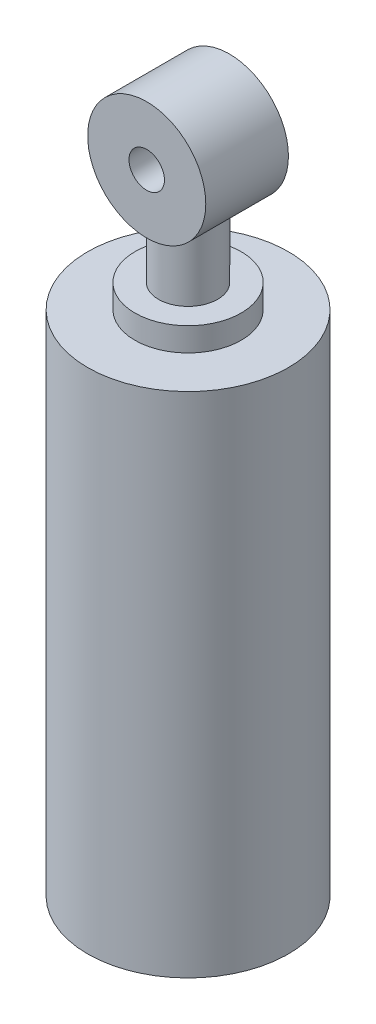
from build123d import *

# Parameters (mm, degrees)
SKETCH_1_R          = 8.5
EXTRUDE_1_DEPTH     = 43
SKETCH_2_R          = 5
EXTRUDE_2_DEPTH     = 3.5
SKETCH_3_R          = 2.5
EXTRUDE_3_DEPTH     = 9
SKETCH_4_R          = 1.5
CUT_EXTRUDE_1_DEPTH = 10
SKETCH_5_R          = 4.5
SKETCH_5_R_2        = 2.5
EXTRUDE_4_DEPTH     = 2


with BuildPart() as part:
    # 草图1 → 凸台-拉伸1 (new body)
    with BuildSketch(Plane(origin=(0, 0, 0), x_dir=(1, 0, 0), z_dir=(0, 1, 0))):
        with Locations(Location((0, 0, 0), (0, 0, 270))):
            Circle(SKETCH_1_R)
    extrude(amount=EXTRUDE_1_DEPTH)



with BuildPart() as body_2:
    # 草图2 → 凸台-拉伸2 (new, symmetric)
    with BuildSketch(Plane.XY):
        with Locations((0, 55)):
            Circle(SKETCH_2_R)
    extrude(amount=EXTRUDE_2_DEPTH, both=True)


with BuildPart() as part_1:
    add(part.part)

    add(body_2.part)  # 凸台-拉伸3 merges body 2
    # 草图3 → 凸台-拉伸3 (add)
    with BuildSketch(Plane(origin=(0, 43, 0), x_dir=(1, 0, 0), z_dir=(0, 1, 0))):
        with Locations(Location((0, 0, 0), (0, 0, 90))):
            Circle(SKETCH_3_R)
    extrude(amount=EXTRUDE_3_DEPTH)

    # 草图4 → 切除-拉伸1 (cut)
    with BuildSketch(Plane.XY.offset(3.5)):
        with Locations((0, 55)):
            Circle(SKETCH_4_R)
    extrude(amount=-CUT_EXTRUDE_1_DEPTH, mode=Mode.SUBTRACT)

    # 草图5 → 凸台-拉伸4 (add)
    with BuildSketch(Plane(origin=(0, 43, 0), x_dir=(1, 0, 0), z_dir=(0, 1, 0))):
        with Locations(Location((0, 0, 0), (0, 0, 270))):
            Circle(SKETCH_5_R)
        with Locations(Location((0, 0, 0), (0, 0, 90))):
            Circle(SKETCH_5_R_2, mode=Mode.SUBTRACT)
    extrude(amount=EXTRUDE_4_DEPTH)


solid = part_1.part
